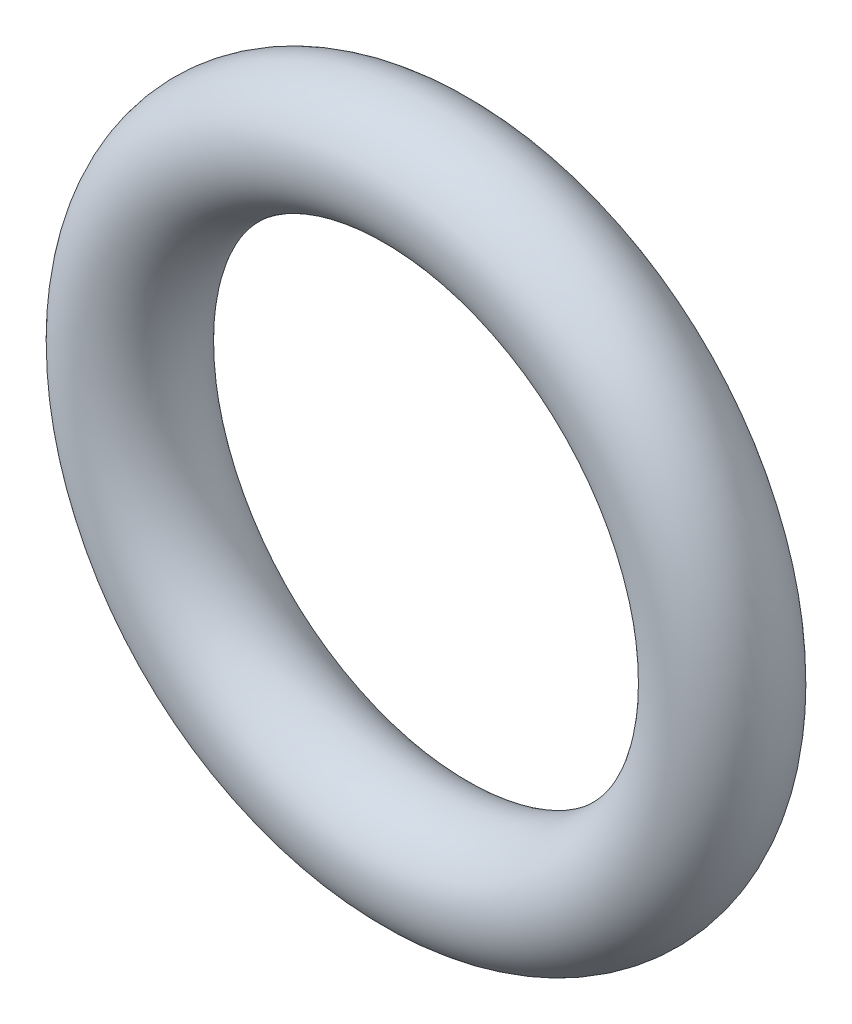
from build123d import *

# Parameters (mm, degrees)
SKETCH1_R = 2


with BuildPart() as part:
    # Sketch1 → Revolve1 (revolve)
    with BuildSketch(Plane(origin=(0, 0, 0), x_dir=(0, -1, 0), z_dir=(1, 0, 0)), mode=Mode.PRIVATE) as revolve1_sk:
        with Locations((10, 0)):
            Circle(SKETCH1_R)
    revolve(revolve1_sk.sketch.rotate(Axis((0, 0, 2), (0, 0, -1)), 270), axis=Axis((0, 0, 2), (0, 0, -1)))


solid = part.part
